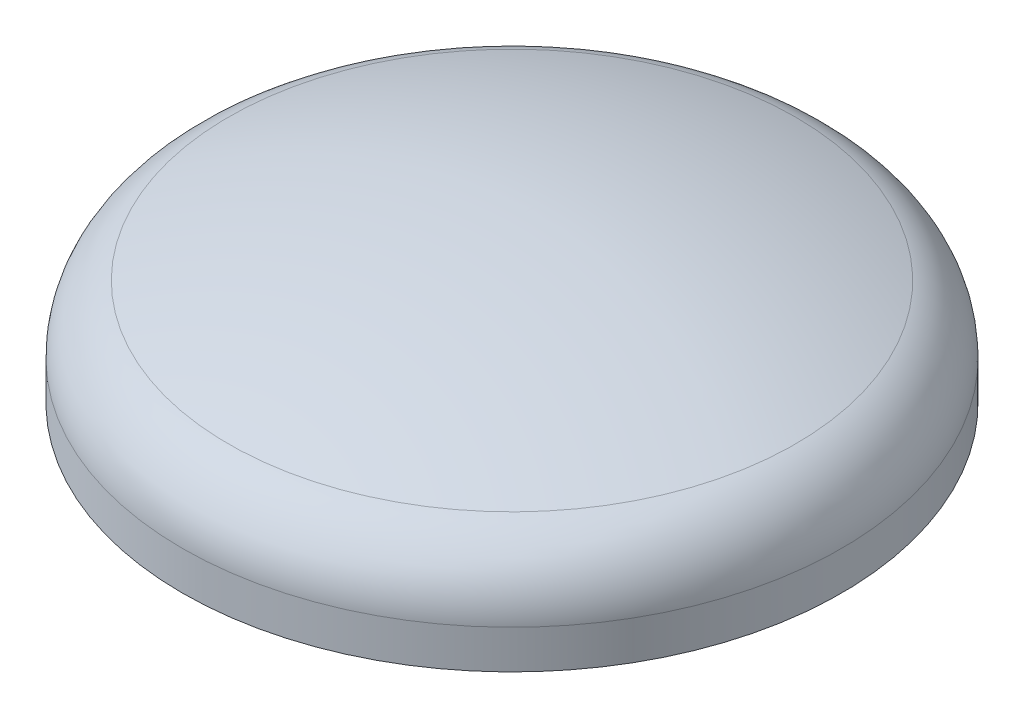
from build123d import *

# Parameters (mm, degrees)
VACIADO1_T = -9.525


with BuildPart() as part:
    # Croquis1 → Revolución1 (revolve)
    with BuildSketch(Plane.XY, mode=Mode.PRIVATE) as revoluci_n1_sk:
        with BuildLine():
            Line((0, 0), (-228.6, 0))
            Line((-228.6, 0), (-228.6, 26.842076509))
            ThreePointArc((-228.6, 26.842076509), (-219.814946199, 55.149817673), (-196.546871607, 73.510157673))
            ThreePointArc((-196.546871607, 73.510157673), (-99.952714016, 100.800250261), (0, 110))
            Line((0, 110), (0, 0))
        make_face()
    revolve(revoluci_n1_sk.sketch.rotate(Axis((0, 0, 0), (0, 1, 0)), 270), axis=Axis((0, 0, 0), (0, 1, 0)))

    # Vaciado1
    vaciado1_openings = [part.faces().sort_by_distance(p)[0] for p in [
        (0, 0, 0),
    ]]
    offset(amount=VACIADO1_T, openings=vaciado1_openings, kind=Kind.INTERSECTION)


solid = part.part
